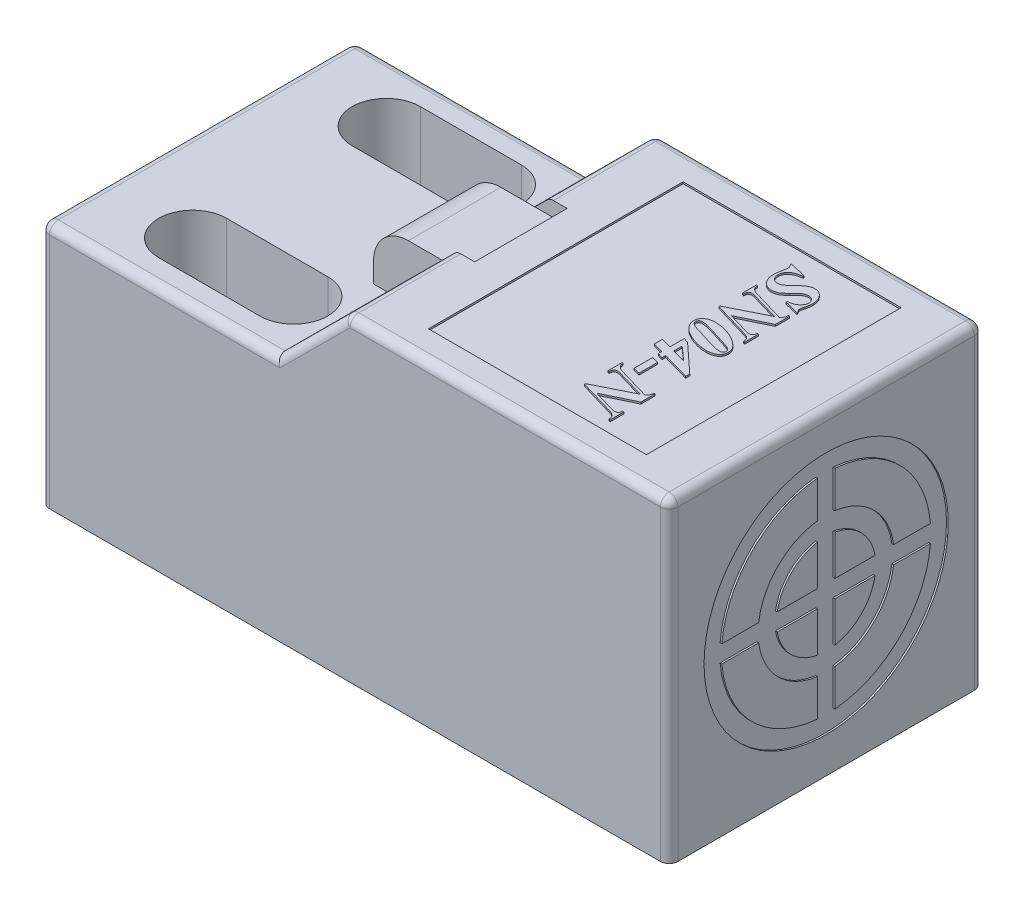
from build123d import *

# Parameters (mm, degrees)
EXTRUDE1_DEPTH  = 18
EXTRUDE2_DEPTH  = 17.9
LPATTERN1_COUNT = 2
LPATTERN1_PITCH = 11.1
SKETCH3_W       = 5.8
SKETCH3_H       = 5.3
EXTRUDE3_DEPTH  = 5
SKETCH4_W       = 5.8
SKETCH4_H       = 5.3
EXTRUDE4_DEPTH  = 1.85
FILLET1_R       = 2
EXTRUDE5_DEPTH  = 1.2
SKETCH6_R       = 1.6
EXTRUDE6_DEPTH  = 1
SKETCH7_W       = 12.5
SKETCH7_H       = 14.6
EXTRUDE7_DEPTH  = 0.1
SKETCH8_R       = 7
EXTRUDE8_DEPTH  = 0.1
FILLET3_R       = 0.5
EXTRUDE10_DEPTH = 0.1


with BuildPart() as part:
    # Sketch1 → Extrude1 (new body)
    with BuildSketch(Plane.XY):
        Polygon((-66.946751975, 32.479243645), (-48.446751975, 32.479243645), (-48.446751975, 14.379243645), (-84.466751975, 14.379243645), (-84.466751975, 28.479243645), (-70.966751975, 28.479243645), align=None)
    extrude(amount=EXTRUDE1_DEPTH)

    # Sketch2 → Extrude2 (cut)
    with BuildSketch(Plane(origin=(0, 28.479243645, 0), x_dir=(1, 0, 0), z_dir=(0, 1, 0))):
        with BuildLine():
            Line((-79.216751975, -12.6), (-73.416751975, -12.6))
            ThreePointArc((-73.416751975, -12.6), (-71.466751975, -14.55), (-73.416751975, -16.5))
            Line((-73.416751975, -16.5), (-79.216751975, -16.5))
            ThreePointArc((-79.216751975, -16.5), (-81.166751975, -14.55), (-79.216751975, -12.6))
        make_face()
    extrude2 = extrude(amount=-EXTRUDE2_DEPTH, mode=Mode.SUBTRACT)

    # LPattern1: Extrude2 ×2
    with Locations(*[(0, 0, -i * LPATTERN1_PITCH) for i in range(1, LPATTERN1_COUNT)]):
        add(extrude2, mode=Mode.SUBTRACT)

    # Sketch3 → Extrude3 (add)
    with BuildSketch(Plane(origin=(0, 28.479243645, 0), x_dir=(1, 0, 0), z_dir=(0, 1, 0))):
        with Locations((-68.846751975, -9)):
            Rectangle(SKETCH3_W, SKETCH3_H)
    extrude(amount=EXTRUDE3_DEPTH)

    # Sketch4 → Extrude4 (cut)
    with BuildSketch(Plane(origin=(0, 33.479243645, 0), x_dir=(1, 0, 0), z_dir=(0, 1, 0))):
        with Locations((-68.846751975, -9)):
            Rectangle(SKETCH4_W, SKETCH4_H)
    extrude(amount=-EXTRUDE4_DEPTH, mode=Mode.SUBTRACT)

    # Fillet1
    fillet1_edges = [part.edges().sort_by_distance(p)[0] for p in [
        (-71.746751975, 31.629243645, 9),
    ]]
    fillet(fillet1_edges, radius=FILLET1_R)

    # Sketch5 → Extrude5 (add)
    with BuildSketch(Plane.ZY.offset(84.466751975)):
        with BuildLine():
            Line((5, 14.379243645), (13, 14.379243645))
            Line((13, 14.379243645), (13, 20.389243645))
            ThreePointArc((13, 20.389243645), (11.831356057, 23.210599701), (9.01, 24.379243645))
            Line((9.01, 24.379243645), (8.99, 24.379243645))
            ThreePointArc((8.99, 24.379243645), (6.168643943, 23.210599701), (5, 20.389243645))
            Line((5, 20.389243645), (5, 14.379243645))
        make_face()
    extrude(amount=EXTRUDE5_DEPTH)

    # Sketch6 → Extrude6 (add)
    with BuildSketch(Plane.ZY.offset(85.666751975)):
        with Locations(Location((8.99, 20.389243645, 0), (0, 0, 180))):
            Circle(SKETCH6_R)
    extrude(amount=EXTRUDE6_DEPTH)

    # Sketch7 → Extrude7 (cut)
    with BuildSketch(Plane(origin=(0, 32.479243645, 0), x_dir=(1, 0, 0), z_dir=(0, 1, 0))):
        with Locations((-57.696751975, -9)):
            Rectangle(SKETCH7_W, SKETCH7_H)
    extrude(amount=-EXTRUDE7_DEPTH, mode=Mode.SUBTRACT)

    # Sketch8 → Extrude8 (cut)
    with BuildSketch(Plane(origin=(-48.446751975, 0, 0), x_dir=(0, 0, -1), z_dir=(1, 0, 0))):
        with Locations((-9, 23.429243645)):
            Circle(SKETCH8_R)
        with BuildLine():
            Line((-9.5, 26.235041214), (-9.5, 23.929243645))
            Line((-9.5, 23.929243645), (-11.805797569, 23.929243645))
            ThreePointArc((-11.805797569, 23.929243645), (-11.015254326, 25.444497971), (-9.5, 26.235041214))
        make_face(mode=Mode.SUBTRACT)
        with BuildLine():
            Line((-14.979130372, 23.929243645), (-12.867815921, 23.929243645))
            ThreePointArc((-12.867815921, 23.929243645), (-11.757716447, 26.186960091), (-9.5, 27.297059566))
            Line((-9.5, 27.297059566), (-9.5, 29.408374016))
            ThreePointArc((-9.5, 29.408374016), (-13.242640687, 27.671884332), (-14.979130372, 23.929243645))
        make_face(mode=Mode.SUBTRACT)
        with BuildLine():
            Line((-8.5, 26.235041214), (-8.5, 23.929243645))
            Line((-8.5, 23.929243645), (-6.194202431, 23.929243645))
            ThreePointArc((-6.194202431, 23.929243645), (-6.984745674, 25.444497971), (-8.5, 26.235041214))
        make_face(mode=Mode.SUBTRACT)
        with BuildLine():
            Line((-8.5, 29.408374016), (-8.5, 27.297059566))
            ThreePointArc((-8.5, 27.297059566), (-6.242283553, 26.186960091), (-5.132184079, 23.929243645))
            Line((-5.132184079, 23.929243645), (-3.020869628, 23.929243645))
            ThreePointArc((-3.020869628, 23.929243645), (-4.757359313, 27.671884332), (-8.5, 29.408374016))
        make_face(mode=Mode.SUBTRACT)
        with BuildLine():
            Line((-5.132184079, 22.929243645), (-3.020869628, 22.929243645))
            ThreePointArc((-3.020869628, 22.929243645), (-4.757359313, 19.186602957), (-8.5, 17.450113273))
            Line((-8.5, 17.450113273), (-8.5, 19.561427723))
            ThreePointArc((-8.5, 19.561427723), (-6.242283553, 20.671527198), (-5.132184079, 22.929243645))
        make_face(mode=Mode.SUBTRACT)
        with BuildLine():
            Line((-14.979130372, 22.929243645), (-12.867815921, 22.929243645))
            ThreePointArc((-12.867815921, 22.929243645), (-11.757716447, 20.671527198), (-9.5, 19.561427723))
            Line((-9.5, 19.561427723), (-9.5, 17.450113273))
            ThreePointArc((-9.5, 17.450113273), (-13.242640687, 19.186602957), (-14.979130372, 22.929243645))
        make_face(mode=Mode.SUBTRACT)
        with BuildLine():
            Line((-9.5, 22.929243645), (-9.5, 20.623446075))
            ThreePointArc((-9.5, 20.623446075), (-11.015254326, 21.413989318), (-11.805797569, 22.929243645))
            Line((-11.805797569, 22.929243645), (-9.5, 22.929243645))
        make_face(mode=Mode.SUBTRACT)
        with BuildLine():
            Line((-8.5, 22.929243645), (-8.5, 20.623446075))
            ThreePointArc((-8.5, 20.623446075), (-6.984745674, 21.413989318), (-6.194202431, 22.929243645))
            Line((-6.194202431, 22.929243645), (-8.5, 22.929243645))
        make_face(mode=Mode.SUBTRACT)
    extrude(amount=-EXTRUDE8_DEPTH, mode=Mode.SUBTRACT)

    # Fillet3
    fillet3_edges = [part.edges().sort_by_distance(p)[0] for p in [
        (-66.946751975, 32.479243645, 3.175),
        (-66.946751975, 32.479243645, 14.825),
        (-57.696751975, 32.479243645, 18),
        (-68.956751975, 30.479243645, 18),
        (-77.716751975, 28.479243645, 18),
        (-84.466751975, 21.429243645, 18),
        (-48.446751975, 23.429243645, 18),
        (-84.466751975, 28.479243645, 9),
        (-84.466751975, 21.429243645, 0),
        (-77.716751975, 28.479243645, 0),
        (-68.956751975, 30.479243645, 0),
        (-48.446751975, 23.429243645, 0),
        (-48.446751975, 32.479243645, 9),
        (-57.696751975, 32.479243645, 0),
    ]]
    fillet(fillet3_edges, radius=FILLET3_R)

    # Sketch12 → Extrude10 (add)
    # profile 1 of 6: a face of its own
    with BuildSketch(Plane(origin=(0, 32.379243645, 0), x_dir=(-1, 0, 0), z_dir=(0, 1, 0))):
        with BuildLine():
            Line((54.217585308, 13.848090278), (55.926569683, 14.672743056))
            Line((55.926569683, 14.672743056), (54.697728537, 15.036241319))
            add(Edge.make_bspline(
                [(54.697728537, 15.036241319), (54.680770727, 15.040417409), (54.647928955, 15.048505139), (54.599724774, 15.056993208), (54.554470721, 15.063025175), (54.525220345, 15.063622276), (54.511096593, 15.06391059)],
                knots=[0, 0, 0, 0, 1.107668079, 2.145193349, 3.104393425, 4, 4, 4, 4], degree=3))
            add(Edge.make_bspline(
                [(54.511096593, 15.06391059), (54.495660528, 15.063188838), (54.465825954, 15.061793846), (54.423520353, 15.050905397), (54.386009201, 15.032506175), (54.353030605, 15.006683404), (54.326421974, 14.970974423), (54.306166824, 14.925521479), (54.293462491, 14.869711329), (54.289272375, 14.829052805), (54.287029753, 14.807291667)],
                knots=[0, 0, 0, 0, 0.962118062, 1.859566006, 2.702087471, 3.553025342, 4.446494084, 5.451059709, 6.635763526, 8, 8, 8, 8], degree=3))
            Line((54.287029753, 14.807291667), (54.217585308, 14.827365451))
            Line((54.217585308, 14.827365451), (54.217585308, 15.614040799))
            Line((54.217585308, 15.614040799), (54.287029753, 15.595594618))
            add(Edge.make_bspline(
                [(54.287029753, 15.595594618), (54.289286674, 15.571630477), (54.293663741, 15.525154502), (54.310486441, 15.459042694), (54.335936725, 15.399579854), (54.363275272, 15.354199491), (54.392013639, 15.32227373), (54.417481963, 15.298496648), (54.448932431, 15.277304402), (54.484255978, 15.256157011), (54.523972054, 15.235110284), (54.569197382, 15.216826207), (54.618575853, 15.197962016), (54.653530655, 15.187220158), (54.671686871, 15.181640625)],
                knots=[0, 0, 0, 0, 1.409162005, 2.732924069, 3.976992883, 5.191366036, 5.81448287, 6.489594852, 7.227577051, 8.030922995, 8.903111447, 9.857746322, 10.887271026, 12, 12, 12, 12], degree=3))
            Line((54.671686871, 15.181640625), (56.717585308, 14.582139757))
            Line((56.717585308, 14.582139757), (56.717585308, 14.520833333))
            Line((56.717585308, 14.520833333), (54.628284093, 13.475911458))
            Line((54.628284093, 13.475911458), (56.278132183, 12.99468316))
            add(Edge.make_bspline(
                [(56.278132183, 12.99468316), (56.305120853, 12.987961491), (56.355417393, 12.975434875), (56.407152473, 12.97264638), (56.431126975, 12.971354167)],
                knots=[0, 0, 0, 0, 1.073181976, 2, 2, 2, 2], degree=3))
            add(Edge.make_bspline(
                [(56.431126975, 12.971354167), (56.446775033, 12.971935765), (56.477170895, 12.9730655), (56.520027609, 12.986041052), (56.558083011, 13.006488341), (56.591007111, 13.035434664), (56.617629686, 13.073943195), (56.63561898, 13.122344572), (56.646271582, 13.179947477), (56.647487184, 13.221410316), (56.648140864, 13.243706597)],
                knots=[0, 0, 0, 0, 0.945284894, 1.836186267, 2.684296895, 3.545886039, 4.46673086, 5.490054683, 6.650298778, 8, 8, 8, 8], degree=3))
            Line((56.648140864, 13.243706597), (56.717585308, 13.227430556))
            Line((56.717585308, 13.227430556), (56.717585308, 12.417426215))
            Line((56.717585308, 12.417426215), (56.648140864, 12.433702257))
            add(Edge.make_bspline(
                [(56.648140864, 12.433702257), (56.647971318, 12.449987788), (56.647660068, 12.479884593), (56.644547386, 12.521040216), (56.63933653, 12.554709903), (56.632637568, 12.573918393), (56.629694683, 12.582356771)],
                knots=[0, 0, 0, 0, 1.29731058, 2.381589017, 3.289024671, 4, 4, 4, 4], degree=3))
            add(Edge.make_bspline(
                [(56.629694683, 12.582356771), (56.624140867, 12.595416153), (56.612704566, 12.622307756), (56.586595207, 12.659979875), (56.554461873, 12.697252537), (56.515886075, 12.734622762), (56.468783261, 12.769419962), (56.412526981, 12.801089882), (56.34696509, 12.82904401), (56.29926507, 12.843761717), (56.27433444, 12.851453993)],
                knots=[0, 0, 0, 0, 0.73623138, 1.516032042, 2.369722431, 3.294175814, 4.302225401, 5.405591194, 6.644020553, 8, 8, 8, 8], degree=3))
            Line((56.27433444, 12.851453993), (54.45901326, 13.382052951))
            add(Edge.make_bspline(
                [(54.45901326, 13.382052951), (54.442312569, 13.367118213), (54.411205191, 13.339300168), (54.37160966, 13.297050314), (54.341169804, 13.258973076), (54.318437097, 13.222982605), (54.304452683, 13.183716381), (54.295198532, 13.13881583), (54.288629426, 13.086010291), (54.28758678, 13.048055097), (54.287029753, 13.027777778)],
                knots=[0, 0, 0, 0, 1.306037617, 2.432678186, 3.371504194, 4.147401941, 4.901566013, 5.786923011, 6.817677811, 8, 8, 8, 8], degree=3))
            Line((54.287029753, 13.027777778), (54.217585308, 13.027777778))
            Line((54.217585308, 13.027777778), (54.217585308, 13.848090278))
        make_face()
    # profile 2 of 6: a face of its own
    with BuildSketch(Plane(origin=(0, 32.379243645, 0), x_dir=(-1, 0, 0), z_dir=(0, 1, 0))):
        Polygon((55.710640864, 11.395833333), (55.710640864, 12.472222222), (56.092585308, 12.368055556), (56.092585308, 11.291666667), align=None)
    # profile 3 of 6: a face of its own
    with BuildSketch(Plane(origin=(0, 32.379243645, 0), x_dir=(-1, 0, 0), z_dir=(0, 1, 0))):
        Polygon((56.12730753, 10.274956597), (56.12730753, 9.451388889), (55.834881315, 9.555555556), (54.217585308, 11.048611111), (54.217585308, 11.281901042), (55.81480753, 10.831054687), (55.81480753, 11.048611111), (56.12730753, 10.944444444), (56.12730753, 10.743164062), (56.717585308, 10.576605903), (56.717585308, 10.108398437), align=None)
        Polygon((55.81480753, 10.362847222), (55.036812739, 10.582573785), (55.81480753, 9.886501736), align=None, mode=Mode.SUBTRACT)
    # profile 4 of 6: a face of its own
    with BuildSketch(Plane(origin=(0, 32.379243645, 0), x_dir=(-1, 0, 0), z_dir=(0, 1, 0))):
        with BuildLine():
            add(Edge.make_bspline(
                [(54.182863086, 8.87358941), (54.184073107, 8.902277151), (54.186429627, 8.95814661), (54.206051358, 9.038769036), (54.238065837, 9.113086374), (54.28410285, 9.179601659), (54.339840378, 9.238578555), (54.404850306, 9.289131258), (54.478375762, 9.33064365), (54.559399701, 9.362355092), (54.643984551, 9.385996948), (54.729207587, 9.403420534), (54.813692255, 9.415005581), (54.870037246, 9.41611673), (54.89792385, 9.416666667)],
                knots=[0, 0, 0, 0, 1.025818678, 1.997784809, 2.951578492, 3.90684308, 4.87770903, 5.846370871, 6.843684404, 7.889571479, 8.953121545, 9.984075258, 11.002266316, 12, 12, 12, 12], degree=3))
            add(Edge.make_bspline(
                [(54.89792385, 9.416666667), (54.946602995, 9.415663052), (55.04488093, 9.413636864), (55.193295036, 9.398996546), (55.343857591, 9.375143042), (55.495133524, 9.341338623), (55.64475773, 9.300364767), (55.789328928, 9.250609989), (55.928307477, 9.194577375), (56.05964948, 9.129825518), (56.183530154, 9.061208726), (56.297225446, 8.987658834), (56.401138961, 8.911074603), (56.463552935, 8.854921635), (56.494061003, 8.827473958)],
                knots=[0, 0, 0, 0, 1.008291525, 2.035631669, 3.086338786, 4.164339831, 5.244993396, 6.298181935, 7.329856982, 8.346844928, 9.329642355, 10.261731119, 11.150330902, 12, 12, 12, 12], degree=3))
            add(Edge.make_bspline(
                [(56.494061003, 8.827473958), (56.511999376, 8.809380068), (56.548089878, 8.772976679), (56.595539799, 8.711258763), (56.639963861, 8.645136554), (56.678329319, 8.573606989), (56.711062611, 8.499302649), (56.735488665, 8.423098316), (56.749137295, 8.345470029), (56.751252996, 8.293487786), (56.75230753, 8.267578125)],
                knots=[0, 0, 0, 0, 0.966109116, 1.943730468, 2.948841606, 3.986878108, 5.019705229, 6.02694666, 7.016565284, 8, 8, 8, 8], degree=3))
            add(Edge.make_bspline(
                [(56.75230753, 8.267578125), (56.751262696, 8.243982671), (56.749187726, 8.197123741), (56.732562279, 8.128517228), (56.70395784, 8.063796757), (56.666293972, 8.002057848), (56.616694827, 7.946110483), (56.557508962, 7.895635422), (56.487839387, 7.85230173), (56.40945265, 7.816096574), (56.325179526, 7.786477098), (56.236660825, 7.765265233), (56.14521883, 7.752580866), (56.08322121, 7.750866321), (56.051895204, 7.75)],
                knots=[0, 0, 0, 0, 0.876508289, 1.740684488, 2.604860687, 3.498449149, 4.417959991, 5.371704122, 6.380730511, 7.457361276, 8.575684992, 9.695845883, 10.835762669, 12, 12, 12, 12], degree=3))
            add(Edge.make_bspline(
                [(56.051895204, 7.75), (56.01697697, 7.750324468), (55.94705627, 7.750974185), (55.842272889, 7.759160261), (55.737323416, 7.771117017), (55.632182659, 7.786957846), (55.52719588, 7.809254594), (55.422096078, 7.834961154), (55.316927598, 7.865988639), (55.247581201, 7.890224554), (55.212593989, 7.902452257)],
                knots=[0, 0, 0, 0, 0.977291217, 1.956939881, 2.940348705, 3.934166456, 4.932012076, 5.943771978, 6.962574992, 8, 8, 8, 8], degree=3))
            add(Edge.make_bspline(
                [(55.212593989, 7.902452257), (55.156024735, 7.924098005), (55.045344794, 7.966448752), (54.888262531, 8.041804861), (54.742815702, 8.124126402), (54.631180661, 8.199659151), (54.549555227, 8.262433129), (54.494094262, 8.308135266), (54.443538948, 8.352384521), (54.398406653, 8.395961654), (54.358155105, 8.438102306), (54.32302898, 8.479352121), (54.293903119, 8.520095509), (54.261465337, 8.571628412), (54.229962243, 8.636286645), (54.203318172, 8.715107287), (54.186035986, 8.79417427), (54.183914147, 8.847282195), (54.182863086, 8.87358941)],
                knots=[0, 0, 0, 0, 1.941069275, 3.797777377, 5.578982498, 7.294712676, 8.113378418, 8.879444369, 9.598269669, 10.266598491, 10.889935564, 11.465967569, 12.001762254, 12.494007526, 13.417055888, 14.298911664, 15.157359364, 16, 16, 16, 16], degree=3))
        make_face()
        with BuildLine():
            add(Edge.make_bspline(
                [(54.287029753, 8.895833333), (54.288042002, 8.877841001), (54.289967896, 8.843609005), (54.303127144, 8.802199263), (54.322120838, 8.773549375), (54.340805233, 8.75094087), (54.36542117, 8.728156338), (54.389454289, 8.708090337), (54.413300391, 8.691928999), (54.436475986, 8.678991558), (54.463938061, 8.66495514), (54.496271088, 8.650382963), (54.532932808, 8.634684887), (54.57420812, 8.618473607), (54.620037451, 8.601658577), (54.652142072, 8.590348278), (54.668974197, 8.584418403)],
                knots=[0, 0, 0, 0, 1.427009573, 2.715011359, 3.37936943, 4.143235157, 5.03585629, 6.034815493, 6.623506375, 7.317244058, 8.138210825, 9.068736593, 10.128923508, 11.300701995, 12.584785592, 14, 14, 14, 14], degree=3))
            add(Edge.make_bspline(
                [(54.668974197, 8.584418403), (54.701869723, 8.572971863), (54.769387367, 8.549477987), (54.873447318, 8.51442673), (54.982532774, 8.477811304), (55.097133902, 8.441114344), (55.21703316, 8.403133402), (55.342264402, 8.363936981), (55.472967565, 8.32458109), (55.561802775, 8.297950648), (55.607016732, 8.284396701)],
                knots=[0, 0, 0, 0, 0.848689522, 1.741924347, 2.675560507, 3.652443459, 4.673984296, 5.740206607, 6.849845671, 8, 8, 8, 8], degree=3))
            add(Edge.make_bspline(
                [(55.607016732, 8.284396701), (55.641000335, 8.274397342), (55.705678277, 8.25536646), (55.798045526, 8.229076342), (55.880432113, 8.204645895), (55.953727651, 8.185047214), (56.01706595, 8.167347966), (56.071062768, 8.15346937), (56.115174105, 8.141600201), (56.14175304, 8.136010699), (56.153349197, 8.133572049)],
                knots=[0, 0, 0, 0, 1.4997987, 2.854432285, 4.066034043, 5.137810676, 6.066548964, 6.850269459, 7.498382604, 8, 8, 8, 8], degree=3))
            add(Edge.make_bspline(
                [(56.153349197, 8.133572049), (56.181157321, 8.128083401), (56.234613431, 8.117532466), (56.312633483, 8.106182338), (56.385218072, 8.098489059), (56.432013688, 8.097632846), (56.454455968, 8.097222222)],
                knots=[0, 0, 0, 0, 1.11946557, 2.151970909, 3.113720685, 4, 4, 4, 4], degree=3))
            add(Edge.make_bspline(
                [(56.454455968, 8.097222222), (56.468799826, 8.097810642), (56.496009448, 8.098926845), (56.534553818, 8.108315683), (56.568403318, 8.12407601), (56.596769411, 8.146724824), (56.619529038, 8.173758032), (56.636175391, 8.2041694), (56.646448929, 8.237630983), (56.647566396, 8.260993341), (56.648140864, 8.273003472)],
                knots=[0, 0, 0, 0, 1.171753575, 2.222761309, 3.221697766, 4.201063764, 5.16682289, 6.09339677, 7.019852608, 8, 8, 8, 8], degree=3))
            add(Edge.make_bspline(
                [(56.648140864, 8.273003472), (56.647643881, 8.285533338), (56.646690289, 8.309575205), (56.638752435, 8.343752456), (56.626752723, 8.374954205), (56.61383207, 8.392417042), (56.60745076, 8.401041667)],
                knots=[0, 0, 0, 0, 1.096554762, 2.104030649, 3.063610163, 4, 4, 4, 4], degree=3))
            add(Edge.make_bspline(
                [(56.60745076, 8.401041667), (56.59175107, 8.417977243), (56.558599868, 8.453738123), (56.493394786, 8.496726648), (56.416080054, 8.537522352), (56.357858201, 8.558235252), (56.326960308, 8.569227431)],
                knots=[0, 0, 0, 0, 0.834679871, 1.76249602, 2.812573738, 4, 4, 4, 4], degree=3))
            add(Edge.make_bspline(
                [(56.326960308, 8.569227431), (56.286442754, 8.582583874), (56.201985777, 8.610424764), (56.070167023, 8.654465237), (55.926700936, 8.698738049), (55.772897813, 8.747549639), (55.607686949, 8.797460951), (55.432248398, 8.851763847), (55.245281936, 8.906534566), (55.117274553, 8.944614429), (55.051461176, 8.964192708)],
                knots=[0, 0, 0, 0, 0.7667781, 1.598313649, 2.497813655, 3.465177376, 4.498485164, 5.599661189, 6.765896172, 8, 8, 8, 8], degree=3))
            add(Edge.make_bspline(
                [(55.051461176, 8.964192708), (55.022358885, 8.972375609), (54.966062715, 8.988204808), (54.883993542, 9.010485274), (54.80637077, 9.027917765), (54.733652176, 9.043696954), (54.66552357, 9.054855787), (54.602214027, 9.063196124), (54.54373568, 9.068373989), (54.506222926, 9.069098488), (54.488310135, 9.069444444)],
                knots=[0, 0, 0, 0, 1.262671486, 2.442542029, 3.551035736, 4.585023357, 5.549853143, 6.433318384, 7.251890707, 8, 8, 8, 8], degree=3))
            add(Edge.make_bspline(
                [(54.488310135, 9.069444444), (54.473436268, 9.068819417), (54.445002973, 9.067624599), (54.404491462, 9.058580937), (54.369227667, 9.042112915), (54.339773568, 9.019620384), (54.316126257, 8.993118948), (54.299721436, 8.96293923), (54.288600318, 8.930418908), (54.287559585, 8.907500819), (54.287029753, 8.895833333)],
                knots=[0, 0, 0, 0, 1.198342199, 2.290784159, 3.320977457, 4.309177247, 5.259348682, 6.159699344, 7.063112032, 8, 8, 8, 8], degree=3))
        make_face(mode=Mode.SUBTRACT)
    # profile 5 of 6: a face of its own
    with BuildSketch(Plane(origin=(0, 32.379243645, 0), x_dir=(-1, 0, 0), z_dir=(0, 1, 0))):
        with BuildLine():
            Line((54.217585308, 6.139756944), (55.926569683, 6.964409722))
            Line((55.926569683, 6.964409722), (54.697728537, 7.327907986))
            add(Edge.make_bspline(
                [(54.697728537, 7.327907986), (54.680770727, 7.332084076), (54.647928955, 7.340171806), (54.599724774, 7.348659874), (54.554470721, 7.354691842), (54.525220345, 7.355288943), (54.511096593, 7.355577257)],
                knots=[0, 0, 0, 0, 1.107668079, 2.145193349, 3.104393425, 4, 4, 4, 4], degree=3))
            add(Edge.make_bspline(
                [(54.511096593, 7.355577257), (54.495660528, 7.354855504), (54.465825954, 7.353460512), (54.423520353, 7.342572063), (54.386009201, 7.324172842), (54.353030605, 7.29835007), (54.326421974, 7.262641089), (54.306166824, 7.217188145), (54.293462491, 7.161377995), (54.289272375, 7.120719471), (54.287029753, 7.098958333)],
                knots=[0, 0, 0, 0, 0.962118062, 1.859566006, 2.702087471, 3.553025342, 4.446494084, 5.451059709, 6.635763526, 8, 8, 8, 8], degree=3))
            Line((54.287029753, 7.098958333), (54.217585308, 7.119032118))
            Line((54.217585308, 7.119032118), (54.217585308, 7.905707465))
            Line((54.217585308, 7.905707465), (54.287029753, 7.887261285))
            add(Edge.make_bspline(
                [(54.287029753, 7.887261285), (54.289286674, 7.863297144), (54.293663741, 7.816821169), (54.310486441, 7.750709361), (54.335936725, 7.691246521), (54.363275272, 7.645866158), (54.392013639, 7.613940397), (54.417481963, 7.590163315), (54.448932431, 7.568971069), (54.484255978, 7.547823678), (54.523972054, 7.52677695), (54.569197382, 7.508492874), (54.618575853, 7.489628682), (54.653530655, 7.478886825), (54.671686871, 7.473307292)],
                knots=[0, 0, 0, 0, 1.409162005, 2.732924069, 3.976992883, 5.191366036, 5.81448287, 6.489594852, 7.227577051, 8.030922995, 8.903111447, 9.857746322, 10.887271026, 12, 12, 12, 12], degree=3))
            Line((54.671686871, 7.473307292), (56.717585308, 6.873806424))
            Line((56.717585308, 6.873806424), (56.717585308, 6.8125))
            Line((56.717585308, 6.8125), (54.628284093, 5.767578125))
            Line((54.628284093, 5.767578125), (56.278132183, 5.286349826))
            add(Edge.make_bspline(
                [(56.278132183, 5.286349826), (56.305120853, 5.279628157), (56.355417393, 5.267101542), (56.407152473, 5.264313047), (56.431126975, 5.263020833)],
                knots=[0, 0, 0, 0, 1.073181976, 2, 2, 2, 2], degree=3))
            add(Edge.make_bspline(
                [(56.431126975, 5.263020833), (56.446775033, 5.263602431), (56.477170895, 5.264732167), (56.520027609, 5.277707719), (56.558083011, 5.298155008), (56.591007111, 5.32710133), (56.617629686, 5.365609862), (56.63561898, 5.414011239), (56.646271582, 5.471614143), (56.647487184, 5.513076983), (56.648140864, 5.535373264)],
                knots=[0, 0, 0, 0, 0.945284894, 1.836186267, 2.684296895, 3.545886039, 4.46673086, 5.490054683, 6.650298778, 8, 8, 8, 8], degree=3))
            Line((56.648140864, 5.535373264), (56.717585308, 5.519097222))
            Line((56.717585308, 5.519097222), (56.717585308, 4.709092882))
            Line((56.717585308, 4.709092882), (56.648140864, 4.725368924))
            add(Edge.make_bspline(
                [(56.648140864, 4.725368924), (56.647971318, 4.741654455), (56.647660068, 4.77155126), (56.644547386, 4.812706882), (56.63933653, 4.84637657), (56.632637568, 4.86558506), (56.629694683, 4.874023438)],
                knots=[0, 0, 0, 0, 1.29731058, 2.381589017, 3.289024671, 4, 4, 4, 4], degree=3))
            add(Edge.make_bspline(
                [(56.629694683, 4.874023438), (56.624140867, 4.88708282), (56.612704566, 4.913974422), (56.586595207, 4.951646542), (56.554461873, 4.988919204), (56.515886075, 5.026289429), (56.468783261, 5.061086629), (56.412526981, 5.092756548), (56.34696509, 5.120710677), (56.29926507, 5.135428384), (56.27433444, 5.14312066)],
                knots=[0, 0, 0, 0, 0.73623138, 1.516032042, 2.369722431, 3.294175814, 4.302225401, 5.405591194, 6.644020553, 8, 8, 8, 8], degree=3))
            Line((56.27433444, 5.14312066), (54.45901326, 5.673719618))
            add(Edge.make_bspline(
                [(54.45901326, 5.673719618), (54.442312569, 5.65878488), (54.411205191, 5.630966835), (54.37160966, 5.588716981), (54.341169804, 5.550639743), (54.318437097, 5.514649272), (54.304452683, 5.475383047), (54.295198532, 5.430482496), (54.288629426, 5.377676958), (54.28758678, 5.339721764), (54.287029753, 5.319444444)],
                knots=[0, 0, 0, 0, 1.306037617, 2.432678186, 3.371504194, 4.147401941, 4.901566013, 5.786923011, 6.817677811, 8, 8, 8, 8], degree=3))
            Line((54.287029753, 5.319444444), (54.217585308, 5.319444444))
            Line((54.217585308, 5.319444444), (54.217585308, 6.139756944))
        make_face()
    # profile 6 of 6: a face of its own
    with BuildSketch(Plane(origin=(0, 32.379243645, 0), x_dir=(-1, 0, 0), z_dir=(0, 1, 0))):
        with BuildLine():
            Line((54.182863086, 4.939670139), (55.016196419, 4.724826389))
            Line((55.016196419, 4.724826389), (55.016196419, 4.661892361))
            add(Edge.make_bspline(
                [(55.016196419, 4.661892361), (54.983952693, 4.658295211), (54.922652927, 4.651456533), (54.835971958, 4.635790102), (54.759287907, 4.616300898), (54.712618057, 4.598969097), (54.690675586, 4.590820313)],
                knots=[0, 0, 0, 0, 1.164436095, 2.213753415, 3.160171643, 4, 4, 4, 4], degree=3))
            add(Edge.make_bspline(
                [(54.690675586, 4.590820313), (54.662463088, 4.577761813), (54.607776743, 4.552449571), (54.533894112, 4.504206166), (54.470347887, 4.449537116), (54.416862481, 4.389511697), (54.374913272, 4.324575371), (54.343819264, 4.256793235), (54.325158393, 4.185632811), (54.32289111, 4.137187333), (54.321751975, 4.112847222)],
                knots=[0, 0, 0, 0, 1.164772192, 2.257762961, 3.296524491, 4.300813436, 5.2621575, 6.184974427, 7.088089828, 8, 8, 8, 8], degree=3))
            add(Edge.make_bspline(
                [(54.321751975, 4.112847222), (54.323106658, 4.089722162), (54.32578691, 4.043969028), (54.347461952, 3.977798959), (54.383136342, 3.91663946), (54.431004215, 3.861934511), (54.486868292, 3.815523071), (54.548780312, 3.781822819), (54.61442174, 3.760476501), (54.65977457, 3.75812479), (54.682537565, 3.756944444)],
                knots=[0, 0, 0, 0, 0.991283221, 1.961262563, 2.956158134, 4.013141878, 5.067012261, 6.057291404, 7.024937004, 8, 8, 8, 8], degree=3))
            add(Edge.make_bspline(
                [(54.682537565, 3.756944444), (54.705379119, 3.758003685), (54.751448317, 3.760140069), (54.820230529, 3.773886146), (54.887835231, 3.797990062), (54.94428922, 3.824504258), (54.990837534, 3.853315695), (55.030176832, 3.881834101), (55.074226573, 3.915907576), (55.121914943, 3.956953591), (55.173816969, 4.004197324), (55.230352862, 4.057448626), (55.291088087, 4.117004633), (55.332234943, 4.159584919), (55.353653017, 4.181749132)],
                knots=[0, 0, 0, 0, 1.006211832, 2.029431618, 3.074857896, 4.16150114, 4.7694426, 5.483367748, 6.300755232, 7.221762927, 8.253750506, 9.392011008, 10.642469838, 12, 12, 12, 12], degree=3))
            add(Edge.make_bspline(
                [(55.353653017, 4.181749132), (55.37056517, 4.199555599), (55.403417336, 4.234144984), (55.452601061, 4.283041264), (55.500513517, 4.326832316), (55.545882997, 4.366761217), (55.589992774, 4.40157067), (55.632253682, 4.431853227), (55.672296765, 4.458328999), (55.72360017, 4.486302463), (55.788331486, 4.514320937), (55.868809977, 4.538190938), (55.952631263, 4.552710496), (56.009520072, 4.554599072), (56.038331836, 4.555555556)],
                knots=[0, 0, 0, 0, 1.096869084, 2.130688162, 3.096779678, 3.995702368, 4.829559832, 5.605163399, 6.317629386, 6.971952783, 8.212886945, 9.460062135, 10.713629457, 12, 12, 12, 12], degree=3))
            add(Edge.make_bspline(
                [(56.038331836, 4.555555556), (56.070616622, 4.55431075), (56.134701757, 4.551839818), (56.228784443, 4.531805479), (56.318689872, 4.498163222), (56.403959548, 4.452045087), (56.482938381, 4.393452038), (56.553085271, 4.322128022), (56.613094612, 4.238454222), (56.663164488, 4.143967744), (56.703072978, 4.040481976), (56.731904382, 3.929676597), (56.748805852, 3.812079475), (56.751121175, 3.731500679), (56.75230753, 3.690212674)],
                knots=[0, 0, 0, 0, 0.924401184, 1.834931613, 2.74157633, 3.666645277, 4.603466317, 5.548774843, 6.520966354, 7.543246977, 8.60459553, 9.691699224, 10.817243023, 12, 12, 12, 12], degree=3))
            add(Edge.make_bspline(
                [(56.75230753, 3.690212674), (56.751600516, 3.662519848), (56.750094962, 3.60354925), (56.739524226, 3.510299025), (56.723253565, 3.406935056), (56.704208669, 3.316326564), (56.688649796, 3.242442982), (56.677488372, 3.190850146), (56.669202211, 3.143867125), (56.661046965, 3.102241793), (56.65607519, 3.065217429), (56.651237425, 3.033483545), (56.649182115, 3.006461291), (56.648466492, 2.99016338), (56.648140864, 2.982747396)],
                knots=[0, 0, 0, 0, 1.391795968, 2.963765562, 4.712207913, 6.649939012, 7.616189391, 8.507538189, 9.302667816, 10.014050848, 10.638799604, 11.180000585, 11.626878385, 12, 12, 12, 12], degree=3))
            add(Edge.make_bspline(
                [(56.648140864, 2.982747396), (56.649156504, 2.963121309), (56.65111121, 2.925348823), (56.664666747, 2.879110423), (56.683347096, 2.844564562), (56.701429091, 2.815417322), (56.72483558, 2.783663262), (56.742786306, 2.762021511), (56.75230753, 2.750542535)],
                knots=[0, 0, 0, 0, 1.353604033, 2.605154471, 3.280574317, 4.059749388, 4.970873911, 6, 6, 6, 6], degree=3))
            Line((56.75230753, 2.750542535), (56.75230753, 2.68109809))
            Line((56.75230753, 2.68109809), (55.81480753, 2.892686632))
            Line((55.81480753, 2.892686632), (55.81480753, 2.958875868))
            add(Edge.make_bspline(
                [(55.81480753, 2.958875868), (55.855048277, 2.963310921), (55.932886304, 2.971889682), (56.04411551, 2.994535584), (56.146476343, 3.022381578), (56.23964289, 3.057330214), (56.323552549, 3.100174276), (56.397812056, 3.151637591), (56.462242689, 3.211500266), (56.516311511, 3.279451927), (56.560167298, 3.353729916), (56.591022749, 3.434233379), (56.610348982, 3.519667158), (56.612381454, 3.578345743), (56.613418642, 3.608289931)],
                knots=[0, 0, 0, 0, 1.274434047, 2.465148908, 3.570632615, 4.612564064, 5.593294362, 6.530228718, 7.449035661, 8.352766773, 9.256354292, 10.154341883, 11.058144782, 12, 12, 12, 12], degree=3))
            add(Edge.make_bspline(
                [(56.613418642, 3.608289931), (56.61321502, 3.623143709), (56.612813466, 3.652436232), (56.606387793, 3.695228235), (56.597335184, 3.736327169), (56.584387519, 3.775495856), (56.567184865, 3.812502088), (56.547402432, 3.84823101), (56.522468182, 3.881147311), (56.495123538, 3.912569704), (56.46500831, 3.940925229), (56.43348438, 3.966065409), (56.400685073, 3.987470841), (56.366571479, 4.004995814), (56.330724693, 4.017885793), (56.293975699, 4.02796381), (56.255673836, 4.033197746), (56.229859487, 4.034210753), (56.21682576, 4.034722222)],
                knots=[0, 0, 0, 0, 1.100500849, 2.170252357, 3.201651426, 4.219533149, 5.221832995, 6.224940098, 7.24158406, 8.277420772, 9.3115195, 10.304352844, 11.264114649, 12.211805871, 13.141097292, 14.084508258, 15.032863561, 16, 16, 16, 16], degree=3))
            add(Edge.make_bspline(
                [(56.21682576, 4.034722222), (56.194340923, 4.033887932), (56.149534213, 4.032225399), (56.083031194, 4.018712466), (56.018361389, 3.996106324), (55.965094353, 3.970503428), (55.921198695, 3.94395702), (55.884733915, 3.917559464), (55.843699009, 3.886676835), (55.799317178, 3.849575655), (55.751412463, 3.806823068), (55.699501144, 3.758708035), (55.643829201, 3.705130899), (55.58562457, 3.647226128), (55.527087979, 3.588361039), (55.468398601, 3.533609641), (55.411538255, 3.483499557), (55.356009339, 3.438695041), (55.303210479, 3.397537174), (55.251252023, 3.36238784), (55.201718446, 3.33116287), (55.168395677, 3.313504119), (55.152372635, 3.305013021)],
                knots=[0, 0, 0, 0, 1.024364852, 2.041305345, 3.078919827, 4.140811927, 4.728964379, 5.415139488, 6.19172759, 7.069922031, 8.05097694, 9.118518037, 10.296266436, 11.572895316, 12.861182666, 14.080188435, 15.231057187, 16.315149315, 17.332490705, 18.281431155, 19.173637057, 20, 20, 20, 20], degree=3))
            add(Edge.make_bspline(
                [(55.152372635, 3.305013021), (55.128924017, 3.294246112), (55.082505327, 3.272932029), (55.00842894, 3.252189532), (54.932613676, 3.238542869), (54.880984899, 3.236923932), (54.855063607, 3.236111111)],
                knots=[0, 0, 0, 0, 1.00454218, 1.988583384, 2.990126813, 4, 4, 4, 4], degree=3))
            add(Edge.make_bspline(
                [(54.855063607, 3.236111111), (54.83259564, 3.236667006), (54.788318083, 3.237762508), (54.723013354, 3.248594666), (54.659958924, 3.265724117), (54.599367447, 3.290587393), (54.541117979, 3.321534157), (54.485073301, 3.359507074), (54.431679012, 3.404626139), (54.380690427, 3.455922426), (54.334517149, 3.513104738), (54.293384798, 3.574621357), (54.259079362, 3.640684818), (54.231436005, 3.711142859), (54.209836674, 3.785630632), (54.193987491, 3.864172775), (54.184782619, 3.94697353), (54.183512619, 4.003593957), (54.182863086, 4.032552083)],
                knots=[0, 0, 0, 0, 0.92736185, 1.827549276, 2.726434014, 3.62114988, 4.526775807, 5.446676473, 6.411722204, 7.410048731, 8.429694834, 9.442807667, 10.461851611, 11.498054577, 12.564170868, 13.661445292, 14.803962333, 16, 16, 16, 16], degree=3))
            add(Edge.make_bspline(
                [(54.182863086, 4.032552083), (54.183901227, 4.061697447), (54.186132793, 4.124347707), (54.198824357, 4.224396206), (54.219685727, 4.33677795), (54.238541829, 4.415303197), (54.248509787, 4.456814236)],
                knots=[0, 0, 0, 0, 0.81311223, 1.747848894, 2.809438556, 4, 4, 4, 4], degree=3))
            add(Edge.make_bspline(
                [(54.248509787, 4.456814236), (54.254317422, 4.480644772), (54.264929873, 4.524190969), (54.276683824, 4.584306724), (54.285433338, 4.632707357), (54.286551374, 4.661505949), (54.287029753, 4.673828125)],
                knots=[0, 0, 0, 0, 1.332691976, 2.435264893, 3.330490173, 4, 4, 4, 4], degree=3))
            add(Edge.make_bspline(
                [(54.287029753, 4.673828125), (54.28604344, 4.690955704), (54.284139782, 4.724013224), (54.270160191, 4.76387333), (54.252395236, 4.793598243), (54.234386352, 4.8180758), (54.210831165, 4.84410647), (54.192587198, 4.861144404), (54.182863086, 4.870225694)],
                knots=[0, 0, 0, 0, 1.338457164, 2.583323273, 3.255988033, 4.046106478, 4.958566535, 6, 6, 6, 6], degree=3))
            Line((54.182863086, 4.870225694), (54.182863086, 4.939670139))
        make_face()
    extrude(amount=EXTRUDE10_DEPTH)


solid = part.part
